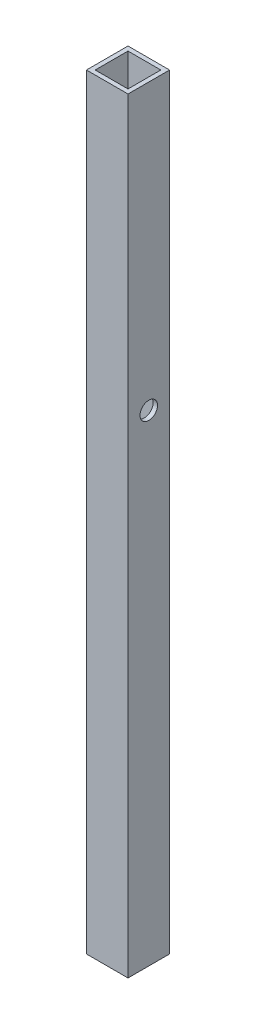
from build123d import *

# Parameters (mm, degrees)
SKETCH1_W           = 19
SKETCH1_H           = 19
SKETCH1_W_2         = 15
SKETCH1_H_2         = 15
EXTRUDE_THIN1_DEPTH = 350
SKETCH2_R           = 4
CUT_EXTRUDE1_DEPTH  = 4


with BuildPart() as part:
    # Sketch1 → Extrude-Thin1 (new body)
    with BuildSketch(Plane(origin=(0, 0, 0), x_dir=(1, 0, 0), z_dir=(0, 1, 0))):
        Rectangle(SKETCH1_W, SKETCH1_H)
        Rectangle(SKETCH1_W_2, SKETCH1_H_2, mode=Mode.SUBTRACT)
    extrude(amount=EXTRUDE_THIN1_DEPTH)

    # Sketch2 → Cut-Extrude1 (cut)
    with BuildSketch(Plane(origin=(9.5, 0, 0), x_dir=(0, 0, -1), z_dir=(1, 0, 0))):
        with Locations((0, 220)):
            Circle(SKETCH2_R)
    extrude(amount=-CUT_EXTRUDE1_DEPTH, mode=Mode.SUBTRACT)


solid = part.part
